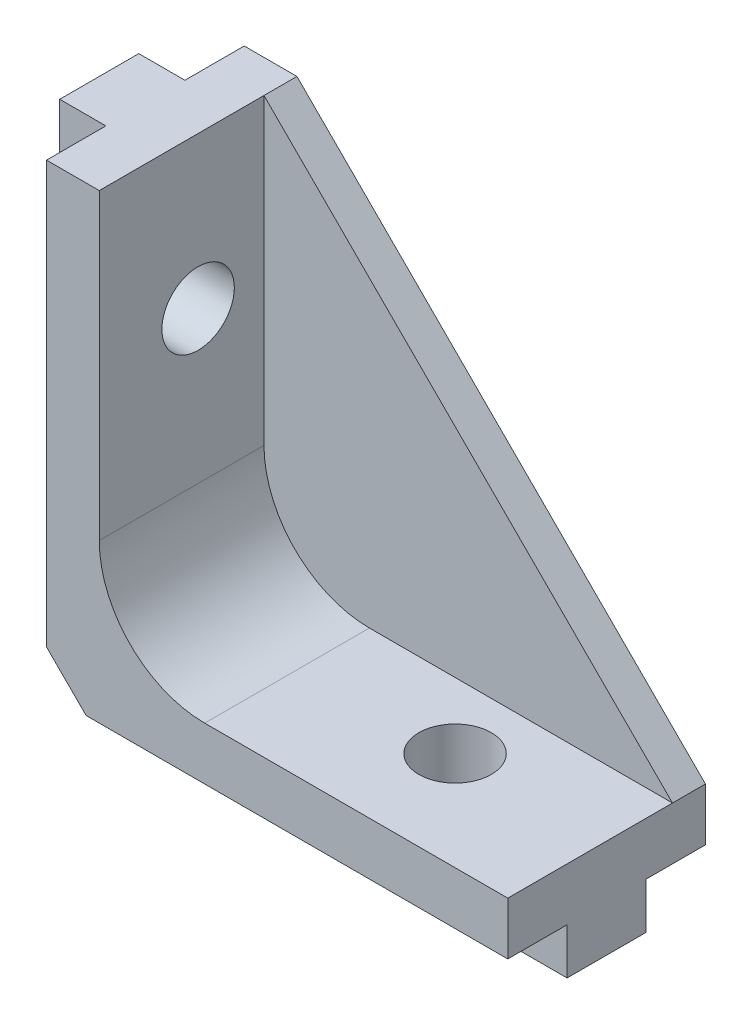
from build123d import *

# Parameters (mm, degrees)
BOSS_EXTRUDE1_DEPTH = 2.5
BOSS_EXTRUDE2_DEPTH = 12.5
SKETCH5_W           = 30.5
SKETCH5_H           = 6
BOSS_EXTRUDE3_DEPTH = 3.5
SKETCH6_W           = 6
SKETCH6_H           = 30.5
BOSS_EXTRUDE4_DEPTH = 3.5
CUT_EXTRUDE1_REACH  = 51.102
SKETCH3_R           = 2.75
CUT_EXTRUDE2_REACH  = 51.102
SKETCH4_R           = 2.75
FILLET1_R           = 8
CHAMFER1_SIZE       = 3


with BuildPart() as part:
    # Sketch1 → Boss-Extrude1 (new body)
    with BuildSketch(Plane.XY):
        Polygon((0, 0), (0, 35), (4, 35), (35, 4), (35, 0), align=None)
    extrude(amount=BOSS_EXTRUDE1_DEPTH)

    # Sketch2 → Boss-Extrude2 (add)
    with BuildSketch(Plane.XY.offset(2.5)):
        Polygon((35, 0), (35, 4), (4, 4), (4, 35), (0, 35), (0, 0), align=None)
    extrude(amount=BOSS_EXTRUDE2_DEPTH)

    # Sketch5 → Boss-Extrude3 (add)
    with BuildSketch(Plane.XZ):
        with Locations((19.75, 7.5)):
            Rectangle(SKETCH5_W, SKETCH5_H)
    extrude(amount=BOSS_EXTRUDE3_DEPTH)

    # Sketch6 → Boss-Extrude4 (add)
    with BuildSketch(Plane.ZY):
        with Locations((7.5, 19.75)):
            Rectangle(SKETCH6_W, SKETCH6_H)
    extrude(amount=BOSS_EXTRUDE4_DEPTH)

    # Sketch3 → Cut-Extrude1 (cut, up to next)
    with BuildSketch(Plane(origin=(4, 0, 0), x_dir=(0, 0, -1), z_dir=(1, 0, 0)), mode=Mode.PRIVATE) as cut_extrude1_sk1:
        with Locations((-7.5, 23.5)):
            Circle(SKETCH3_R)
    cut_extrude1_tool1 = extrude(cut_extrude1_sk1.sketch, amount=-CUT_EXTRUDE1_REACH, mode=Mode.PRIVATE) & part.part
    add(cut_extrude1_tool1.solids().sort_by_distance((4, 23.5, 7.5))[0], mode=Mode.SUBTRACT)

    # Sketch4 → Cut-Extrude2 (cut, up to next)
    with BuildSketch(Plane(origin=(0, 4, 0), x_dir=(1, 0, 0), z_dir=(0, 1, 0)), mode=Mode.PRIVATE) as cut_extrude2_sk1:
        with Locations(Location((23.5, -7.5, 0), (0, 0, 270))):
            Circle(SKETCH4_R)
    cut_extrude2_tool1 = extrude(cut_extrude2_sk1.sketch, amount=-CUT_EXTRUDE2_REACH, mode=Mode.PRIVATE) & part.part
    add(cut_extrude2_tool1.solids().sort_by_distance((23.5, 4, 7.5))[0], mode=Mode.SUBTRACT)

    # Fillet1
    fillet1_edges = [part.edges().sort_by_distance(p)[0] for p in [
        (4, 4, 8.75),
    ]]
    fillet(fillet1_edges, radius=FILLET1_R)

    # Chamfer1
    chamfer1_edges = [part.edges().sort_by_distance(p)[0] for p in [
        (0, 0, 7.5),
    ]]
    chamfer(chamfer1_edges, length=CHAMFER1_SIZE)


solid = part.part
